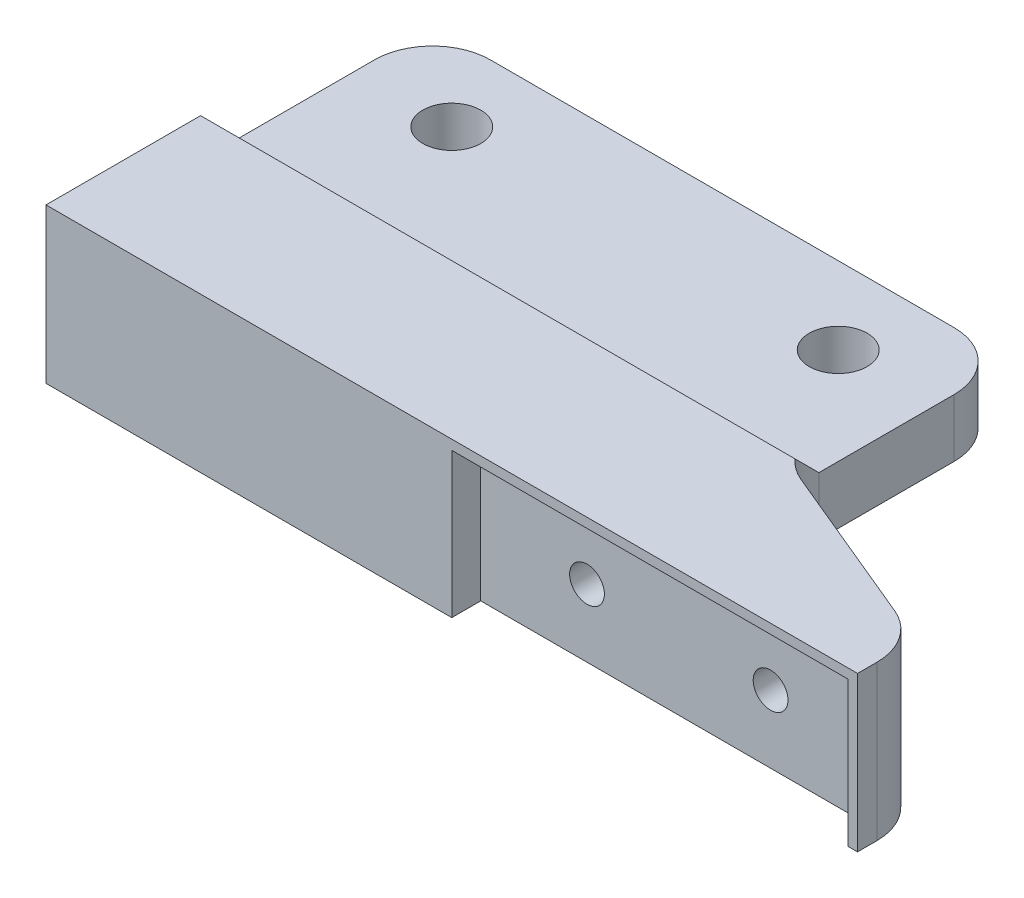
from build123d import *

# Parameters (mm, degrees)
SKETCH_1_R          = 1.5
EXTRUDE_1_DEPTH     = 8
SKETCH_2_W          = 12
SKETCH_2_H          = 3
CUT_EXTRUDE_1_DEPTH = 48.201694885
SKETCH_3_R          = 0.9
CUT_EXTRUDE_2_DEPTH = 6
SKETCH_4_W          = 20.5
SKETCH_4_H          = 7.5
CUT_EXTRUDE_3_DEPTH = 1.5
FILLET_2_R          = 3
FILLET_3_R          = 3


with BuildPart() as part:
    # 草图1 → 凸台-拉伸1 (new body)
    with BuildSketch(Plane(origin=(0, 0, 0), x_dir=(1, 0, 0), z_dir=(0, 1, 0))):
        Polygon((0, 0), (42, 0), (42, 3), (30, 8), (30, 20), (0, 20), align=None)
        with Locations(Location((25, 16, 0), (0, 0, 270))):
            Circle(SKETCH_1_R, mode=Mode.SUBTRACT)
        with Locations(Location((5, 16, 0), (0, 0, 270))):
            Circle(SKETCH_1_R, mode=Mode.SUBTRACT)
    extrude(amount=EXTRUDE_1_DEPTH)

    # 草图2 → 切除-拉伸1 (cut, through all)
    with BuildSketch(Plane.ZY):
        Polygon((-20, 6), (-10, 6), (-8, 8), (-20, 8), align=None)
        with Locations((-14, 1.5)):
            Rectangle(SKETCH_2_W, SKETCH_2_H)
    extrude(amount=-CUT_EXTRUDE_1_DEPTH, mode=Mode.SUBTRACT)

    # 草图3 → 切除-拉伸2 (cut)
    with BuildSketch(Plane.XY):
        with Locations((26.5, 3.5)):
            Circle(SKETCH_3_R)
        with Locations((36, 3.5)):
            Circle(SKETCH_3_R)
    extrude(amount=-CUT_EXTRUDE_2_DEPTH, mode=Mode.SUBTRACT)

    # 草图4 → 切除-拉伸3 (cut)
    with BuildSketch(Plane.XY):
        with Locations((31.25, 3.75)):
            Rectangle(SKETCH_4_W, SKETCH_4_H)
    extrude(amount=-CUT_EXTRUDE_3_DEPTH, mode=Mode.SUBTRACT)

    # 圆角2
    fillet_2_edges = [part.edges().sort_by_distance(p)[0] for p in [
        (0, 4.5, -20),
        (30, 4.5, -20),
        (42, 4, -3),
        (30, 5.5, -8),
    ]]
    fillet(fillet_2_edges, radius=FILLET_2_R)

    # 圆角3
    fillet_3_edges = [part.edges().sort_by_distance(p)[0] for p in [
        (30, 1.5, -8),
    ]]
    fillet(fillet_3_edges, radius=FILLET_3_R)


solid = part.part
